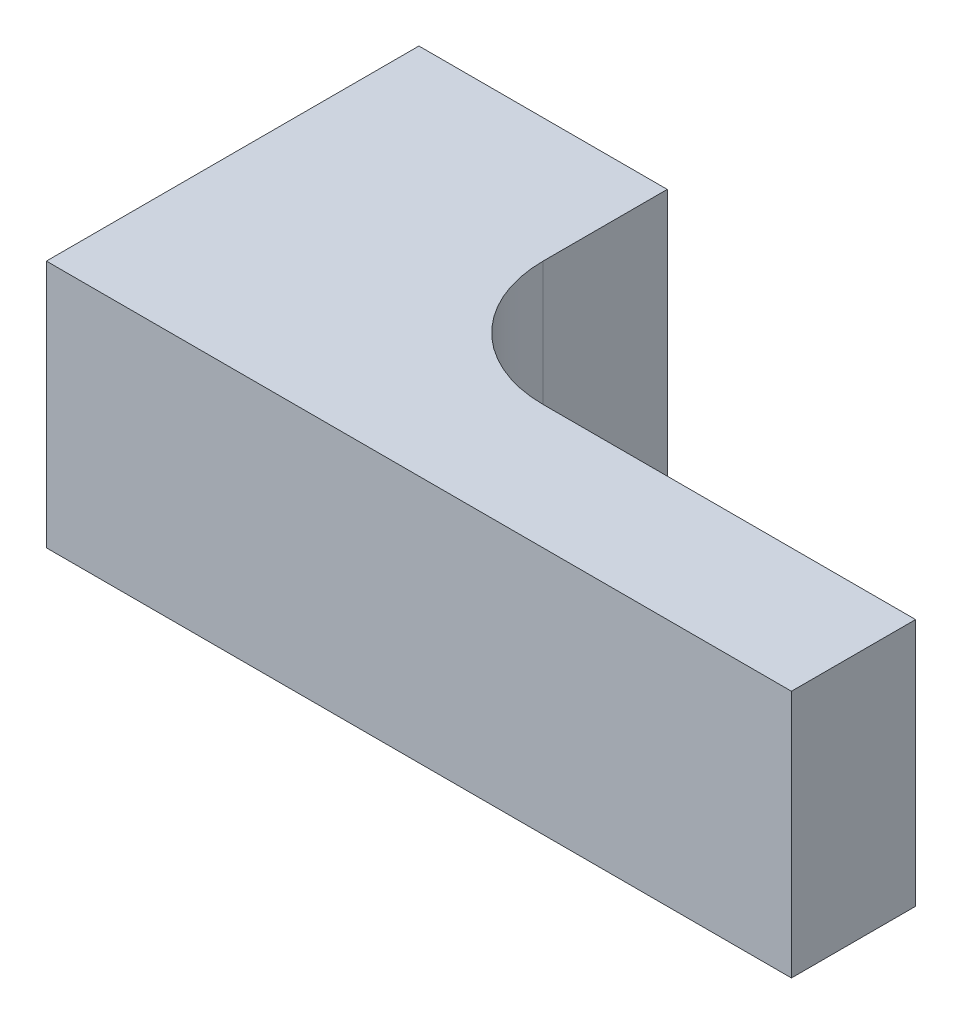
from build123d import *

# Parameters (mm, degrees)
BOSS_EXTRUDE1_DEPTH = 20


with BuildPart() as part:
    # Sketch2 → Boss-Extrude1 (new body)
    with BuildSketch(Plane(origin=(0, 0, 0), x_dir=(1, 0, 0), z_dir=(0, 1, 0))):
        with BuildLine():
            Line((0, 0), (0, -10))
            ThreePointArc((0, -10), (2.928932188, -17.071067812), (10, -20))
            Line((10, -20), (40, -20))
            Line((40, -20), (40, -30))
            Line((40, -30), (-20, -30))
            Line((-20, -30), (-20, 0))
            Line((-20, 0), (0, 0))
        make_face()
    extrude(amount=BOSS_EXTRUDE1_DEPTH)


solid = part.part
